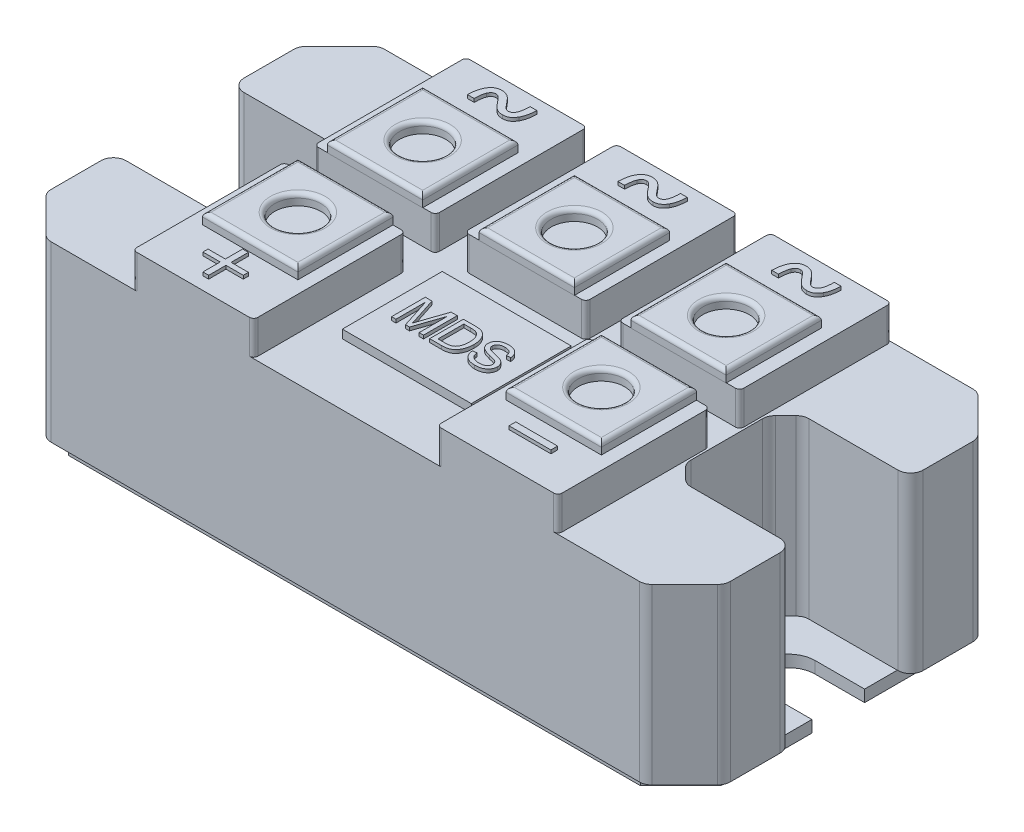
from build123d import *

# Parameters (mm, degrees)
BOSS_EXTRUDE1_DEPTH = 20.6
SKETCH2_R           = 3.125
BOSS_EXTRUDE2_DEPTH = 1.4
SKETCH3_W           = 14.35
SKETCH3_H           = 18
BOSS_EXTRUDE3_DEPTH = 4
SKETCH4_W           = 15.3
SKETCH4_H           = 11.85
BOSS_EXTRUDE4_DEPTH = 1
FILLET1_R           = 0.5
SKETCH5_W           = 11.3
SKETCH5_H           = 11.3
SKETCH5_R           = 2.75
BOSS_EXTRUDE5_DEPTH = 1.3
FILLET2_R           = 0.5
BOSS_EXTRUDE6_DEPTH = 0.4
SKETCH7_W           = 4.962025316
SKETCH7_H           = 0.797468355
BOSS_EXTRUDE7_DEPTH = 0.4


with BuildPart() as part:
    # Sketch1 → Boss-Extrude1 (new body)
    with BuildSketch(Plane(origin=(0, 0, 0), x_dir=(1, 0, 0), z_dir=(0, 1, 0))):
        with BuildLine():
            Line((35.941369055, 19.335660172), (39.835660172, 15.441369055))
            ThreePointArc((39.835660172, 15.441369055), (40.160819299, 14.954734032), (40.275, 14.380708883))
            Line((40.275, 14.380708883), (40.275, 8.5))
            ThreePointArc((40.275, 8.5), (39.835660172, 7.439339828), (38.775, 7))
            Line((38.775, 7), (28.217640687, 7))
            ThreePointArc((28.217640687, 7), (27.643615539, 6.885819299), (27.156980515, 6.560660172))
            Line((27.156980515, 6.560660172), (25.914339828, 5.318019485))
            ThreePointArc((25.914339828, 5.318019485), (25.589180701, 4.831384461), (25.475, 4.257359313))
            Line((25.475, 4.257359313), (25.475, -4.257359313))
            ThreePointArc((25.475, -4.257359313), (25.589180701, -4.831384461), (25.914339828, -5.318019485))
            Line((25.914339828, -5.318019485), (27.156980515, -6.560660172))
            ThreePointArc((27.156980515, -6.560660172), (27.643615539, -6.885819299), (28.217640687, -7))
            Line((28.217640687, -7), (38.775, -7))
            ThreePointArc((38.775, -7), (39.835660172, -7.439339828), (40.275, -8.5))
            Line((40.275, -8.5), (40.275, -14.380708883))
            ThreePointArc((40.275, -14.380708883), (40.160819299, -14.954734032), (39.835660172, -15.441369055))
            Line((39.835660172, -15.441369055), (35.941369055, -19.335660172))
            ThreePointArc((35.941369055, -19.335660172), (35.454734032, -19.660819299), (34.880708883, -19.775))
            Line((34.880708883, -19.775), (-34.880708883, -19.775))
            ThreePointArc((-34.880708883, -19.775), (-35.454734032, -19.660819299), (-35.941369055, -19.335660172))
            Line((-35.941369055, -19.335660172), (-39.835660172, -15.441369055))
            ThreePointArc((-39.835660172, -15.441369055), (-40.160819299, -14.954734032), (-40.275, -14.380708883))
            Line((-40.275, -14.380708883), (-40.275, -8.5))
            ThreePointArc((-40.275, -8.5), (-39.835660172, -7.439339828), (-38.775, -7))
            Line((-38.775, -7), (-28.217640687, -7))
            ThreePointArc((-28.217640687, -7), (-27.643615539, -6.885819299), (-27.156980515, -6.560660172))
            Line((-27.156980515, -6.560660172), (-25.914339828, -5.318019485))
            ThreePointArc((-25.914339828, -5.318019485), (-25.589180701, -4.831384461), (-25.475, -4.257359313))
            Line((-25.475, -4.257359313), (-25.475, 4.257359313))
            ThreePointArc((-25.475, 4.257359313), (-25.589180701, 4.831384461), (-25.914339828, 5.318019485))
            Line((-25.914339828, 5.318019485), (-27.156980515, 6.560660172))
            ThreePointArc((-27.156980515, 6.560660172), (-27.643615539, 6.885819299), (-28.217640687, 7))
            Line((-28.217640687, 7), (-38.775, 7))
            ThreePointArc((-38.775, 7), (-39.835660172, 7.439339828), (-40.275, 8.5))
            Line((-40.275, 8.5), (-40.275, 14.380708883))
            ThreePointArc((-40.275, 14.380708883), (-40.160819299, 14.954734032), (-39.835660172, 15.441369055))
            Line((-39.835660172, 15.441369055), (-35.941369055, 19.335660172))
            ThreePointArc((-35.941369055, 19.335660172), (-35.454734032, 19.660819299), (-34.880708883, 19.775))
            Line((-34.880708883, 19.775), (34.880708883, 19.775))
            ThreePointArc((34.880708883, 19.775), (35.454734032, 19.660819299), (35.941369055, 19.335660172))
        make_face()
    extrude(amount=BOSS_EXTRUDE1_DEPTH)

    # Sketch2 → Boss-Extrude2 (add)
    with BuildSketch(Plane.XZ):
        with BuildLine():
            Line((33.927029227, 18.7), (38.7, 13.927029227))
            Line((38.7, 13.927029227), (38.7, 3.125))
            Line((38.7, 3.125), (32.825, 3.125))
            ThreePointArc((32.825, 3.125), (29.7, 0), (32.825, -3.125))
            Line((32.825, -3.125), (38.7, -3.125))
            Line((38.7, -3.125), (38.7, -13.927029227))
            Line((38.7, -13.927029227), (33.927029227, -18.7))
            Line((33.927029227, -18.7), (-33.927029227, -18.7))
            Line((-33.927029227, -18.7), (-38.7, -13.927029227))
            Line((-38.7, -13.927029227), (-38.7, 13.927029227))
            Line((-38.7, 13.927029227), (-33.927029227, 18.7))
            Line((-33.927029227, 18.7), (33.927029227, 18.7))
        make_face()
        with Locations(Location((-33.325, 0, 0), (0, 0, 270))):
            Circle(SKETCH2_R, mode=Mode.SUBTRACT)
    extrude(amount=BOSS_EXTRUDE2_DEPTH)

    # Sketch3 → Boss-Extrude3 (add)
    with BuildSketch(Plane(origin=(0, 20.6, 0), x_dir=(1, 0, 0), z_dir=(0, 1, 0))):
        with Locations((-18.05, 10.775)):
            Rectangle(SKETCH3_W, SKETCH3_H)
        with Locations((-0.2, 10.775)):
            Rectangle(SKETCH3_W, SKETCH3_H)
        with Locations((-18.05, -10.775)):
            Rectangle(SKETCH3_W, SKETCH3_H)
        with Locations((18.05, -10.775)):
            Rectangle(SKETCH3_W, SKETCH3_H)
        with Locations((18.05, 10.775)):
            Rectangle(SKETCH3_W, SKETCH3_H)
    extrude(amount=BOSS_EXTRUDE3_DEPTH)

    # Sketch4 → Boss-Extrude4 (add)
    with BuildSketch(Plane(origin=(0, 20.6, 0), x_dir=(1, 0, 0), z_dir=(0, 1, 0))):
        with Locations((0, -6.55)):
            Rectangle(SKETCH4_W, SKETCH4_H)
    extrude(amount=BOSS_EXTRUDE4_DEPTH)

    # Fillet1
    fillet1_edges = [part.edges().sort_by_distance(p)[0] for p in [
        (-25.225, 22.6, -19.775),
        (-25.225, 22.6, -1.775),
        (-10.875, 22.6, -1.775),
        (-10.875, 22.6, -19.775),
        (-7.375, 22.6, -19.775),
        (-7.375, 22.6, -1.775),
        (6.975, 22.6, -1.775),
        (6.975, 22.6, -19.775),
        (-25.225, 22.6, 1.775),
        (-25.225, 22.6, 19.775),
        (-10.875, 22.6, 19.775),
        (-10.875, 22.6, 1.775),
        (10.875, 22.6, 19.775),
        (25.225, 22.6, 19.775),
        (25.225, 22.6, 1.775),
        (10.875, 22.6, 1.775),
        (25.225, 22.6, -1.775),
        (25.225, 22.6, -19.775),
        (10.875, 22.6, -19.775),
        (10.875, 22.6, -1.775),
    ]]
    fillet(fillet1_edges, radius=FILLET1_R)

    # Sketch5 → Boss-Extrude5 (add)
    # profile 1 of 5: a face of its own
    with BuildSketch(Plane(origin=(0, 24.6, 0), x_dir=(1, 0, 0), z_dir=(0, 1, 0))):
        with Locations((-18, 7.4)):
            Rectangle(SKETCH5_W, SKETCH5_H)
        with Locations(Location((-18, 7.4, 0), (0, 0, 270))):
            Circle(SKETCH5_R, mode=Mode.SUBTRACT)
    # profile 2 of 5: a face of its own
    with BuildSketch(Plane(origin=(0, 24.6, 0), x_dir=(1, 0, 0), z_dir=(0, 1, 0))):
        with Locations((-18, -7.4)):
            Rectangle(SKETCH5_W, SKETCH5_H)
        with Locations(Location((-18, -7.4, 0), (0, 0, 90))):
            Circle(SKETCH5_R, mode=Mode.SUBTRACT)
    # profile 3 of 5: a face of its own
    with BuildSketch(Plane(origin=(0, 24.6, 0), x_dir=(1, 0, 0), z_dir=(0, 1, 0))):
        with Locations((0, 7.4)):
            Rectangle(SKETCH5_W, SKETCH5_H)
        with Locations(Location((0, 7.4, 0), (0, 0, 270))):
            Circle(SKETCH5_R, mode=Mode.SUBTRACT)
    # profile 4 of 5: a face of its own
    with BuildSketch(Plane(origin=(0, 24.6, 0), x_dir=(1, 0, 0), z_dir=(0, 1, 0))):
        with Locations((18, -7.4)):
            Rectangle(SKETCH5_W, SKETCH5_H)
        with Locations(Location((18, -7.4, 0), (0, 0, 270))):
            Circle(SKETCH5_R, mode=Mode.SUBTRACT)
    # profile 5 of 5: a face of its own
    with BuildSketch(Plane(origin=(0, 24.6, 0), x_dir=(1, 0, 0), z_dir=(0, 1, 0))):
        with Locations((18, 7.4)):
            Rectangle(SKETCH5_W, SKETCH5_H)
        with Locations(Location((18, 7.4, 0), (0, 0, 90))):
            Circle(SKETCH5_R, mode=Mode.SUBTRACT)
    extrude(amount=BOSS_EXTRUDE5_DEPTH)

    # Fillet2
    fillet2_edges = [part.edges().sort_by_distance(p)[0] for p in [
        (-12.35, 25.9, -7.4),
        (-18, 25.9, -13.05),
        (-23.65, 25.9, -7.4),
        (-18, 25.9, -1.75),
        (-18, 25.9, -10.15),
        (-23.65, 25.9, 7.4),
        (-18, 25.9, 13.05),
        (-12.35, 25.9, 7.4),
        (-18, 25.9, 1.75),
        (-18, 25.9, 10.15),
        (18, 25.9, 13.05),
        (23.65, 25.9, 7.4),
        (18, 25.9, 1.75),
        (12.35, 25.9, 7.4),
        (18, 25.9, 4.65),
        (0, 25.9, -1.75),
        (5.65, 25.9, -7.4),
        (0, 25.9, -13.05),
        (-5.65, 25.9, -7.4),
        (0, 25.9, -10.15),
        (23.65, 25.9, -7.4),
        (18, 25.9, -13.05),
        (12.35, 25.9, -7.4),
        (18, 25.9, -1.75),
        (18, 25.9, -4.65),
    ]]
    fillet(fillet2_edges, radius=FILLET2_R)

    # Sketch6 → Boss-Extrude6 (add)
    # profile 1 of 3: a face of its own
    with BuildSketch(Plane(origin=(0, 21.6, 0), x_dir=(1, 0, 0), z_dir=(0, 1, 0))):
        with BuildLine():
            Line((-5.61038961, -8.675), (-5.61038961, -4.675))
            Line((-5.61038961, -4.675), (-4.814123377, -4.675))
            Line((-4.814123377, -4.675), (-3.897727273, -7.506980519))
            Line((-3.897727273, -7.506980519), (-3.714285714, -8.099512987))
            add(Edge.make_bspline(
                [(-3.714285714, -8.099512987), (-3.708124422, -8.080012463), (-3.695183616, -8.039054737), (-3.673424555, -7.974690503), (-3.651579147, -7.903338906), (-3.624964623, -7.826616538), (-3.597600565, -7.743386437), (-3.567452698, -7.654138609), (-3.535017811, -7.558348299), (-3.512462849, -7.492364374), (-3.500811688, -7.458279221)],
                knots=[0, 0, 0, 0, 0.726206643, 1.525280629, 2.41254226, 3.3756825, 4.408698438, 5.523752133, 6.720850731, 8, 8, 8, 8], degree=3))
            Line((-3.500811688, -7.458279221), (-2.540584416, -4.675))
            Line((-2.540584416, -4.675), (-1.818181818, -4.675))
            Line((-1.818181818, -4.675), (-1.818181818, -8.675))
            Line((-1.818181818, -8.675), (-2.337662338, -8.675))
            Line((-2.337662338, -8.675), (-2.337662338, -5.344642857))
            Line((-2.337662338, -5.344642857), (-3.478896104, -8.675))
            Line((-3.478896104, -8.675), (-3.959415584, -8.675))
            Line((-3.959415584, -8.675), (-5.090909091, -5.153084416))
            Line((-5.090909091, -5.153084416), (-5.090909091, -8.675))
            Line((-5.090909091, -8.675), (-5.61038961, -8.675))
        make_face()
    # profile 2 of 3: a face of its own
    with BuildSketch(Plane(origin=(0, 21.6, 0), x_dir=(1, 0, 0), z_dir=(0, 1, 0))):
        with BuildLine():
            Line((-1.090909091, -8.675), (-1.090909091, -4.675))
            Line((-1.090909091, -4.675), (0.254058442, -4.675))
            add(Edge.make_bspline(
                [(0.254058442, -4.675), (0.294377577, -4.674986737), (0.372603763, -4.674961006), (0.485971365, -4.679572288), (0.592082981, -4.684912952), (0.690648411, -4.692785045), (0.781788891, -4.703692315), (0.865406335, -4.715044428), (0.941371973, -4.730837284), (0.989217944, -4.743018746), (1.012175325, -4.748863636)],
                knots=[0, 0, 0, 0, 1.266758978, 2.457734333, 3.564536452, 4.60520355, 5.563769428, 6.448665684, 7.255641162, 8, 8, 8, 8], degree=3))
            add(Edge.make_bspline(
                [(1.012175325, -4.748863636), (1.067694226, -4.766558165), (1.177591326, -4.801583668), (1.331792877, -4.880760389), (1.474656998, -4.978423988), (1.605226169, -5.096491426), (1.72271177, -5.232746722), (1.828070091, -5.385115011), (1.918202597, -5.554773429), (1.981137421, -5.707608358), (2.023812423, -5.83795782), (2.052103887, -5.941188999), (2.07679565, -6.048603554), (2.095836003, -6.160864534), (2.111508386, -6.277514259), (2.121669161, -6.398883909), (2.128362531, -6.524492128), (2.129362499, -6.609785439), (2.12987013, -6.653084416)],
                knots=[0, 0, 0, 0, 1.174939958, 2.325739354, 3.485014877, 4.661046704, 5.869351209, 7.110508248, 8.39375832, 9.741116344, 10.442557281, 11.162270702, 11.901824798, 12.667085315, 13.460627751, 14.277760841, 15.125708784, 16, 16, 16, 16], degree=3))
            add(Edge.make_bspline(
                [(2.12987013, -6.653084416), (2.128955395, -6.708562388), (2.127155521, -6.817723366), (2.117017105, -6.978178875), (2.098046659, -7.13228479), (2.072487384, -7.279782199), (2.038911797, -7.42092757), (1.998830696, -7.555953081), (1.949698762, -7.684166117), (1.89490603, -7.805727351), (1.83393895, -7.919498366), (1.768131114, -8.025116581), (1.698682108, -8.122360501), (1.625190242, -8.211381608), (1.546220898, -8.290393649), (1.464327095, -8.362465832), (1.377817487, -8.425520931), (1.285941937, -8.479323276), (1.188658485, -8.525822861), (1.084845385, -8.565492604), (0.974308394, -8.599781605), (0.85619351, -8.626922699), (0.731069753, -8.649013647), (0.598793655, -8.664126076), (0.45953945, -8.673040333), (0.364461496, -8.674336095), (0.315746753, -8.675)],
                knots=[0, 0, 0, 0, 1.285715154, 2.529831556, 3.723588108, 4.88221712, 5.996958211, 7.083952729, 8.143624279, 9.176239757, 10.172051745, 11.132413866, 12.05807102, 12.939524071, 13.804068042, 14.643979477, 15.465434267, 16.280523422, 17.107819848, 17.961311883, 18.853756929, 19.787553604, 20.767848595, 21.796764639, 22.871136387, 24, 24, 24, 24], degree=3))
            Line((0.315746753, -8.675), (-1.090909091, -8.675))
        make_face()
        with BuildLine():
            Line((-0.571428571, -8.207467532), (0.261363636, -8.207467532))
            add(Edge.make_bspline(
                [(0.261363636, -8.207467532), (0.301959097, -8.206980122), (0.38076802, -8.206033901), (0.495284858, -8.199320752), (0.602408114, -8.18950494), (0.701615776, -8.173346359), (0.79372573, -8.155977999), (0.877362638, -8.130726613), (0.954360275, -8.103850635), (1.024091194, -8.070929487), (1.088016929, -8.033147311), (1.147808523, -7.990580199), (1.204006626, -7.942736971), (1.255592461, -7.888974137), (1.30408184, -7.830799202), (1.34880766, -7.767415501), (1.389306428, -7.69820254), (1.413185643, -7.649455799), (1.425324675, -7.624675325)],
                knots=[0, 0, 0, 0, 1.399613218, 2.717102087, 3.954472952, 5.106316911, 6.182096002, 7.182899304, 8.115414993, 8.991784568, 9.836551414, 10.672671811, 11.51959932, 12.377248504, 13.238441918, 14.12880119, 15.048773465, 16, 16, 16, 16], degree=3))
            add(Edge.make_bspline(
                [(1.425324675, -7.624675325), (1.440041466, -7.589923146), (1.469842725, -7.519550555), (1.508042117, -7.409914671), (1.539437661, -7.29510013), (1.565538626, -7.175354804), (1.585563564, -7.050416961), (1.600387776, -6.920434268), (1.608141092, -6.785484022), (1.609631667, -6.693947873), (1.61038961, -6.647402597)],
                knots=[0, 0, 0, 0, 0.903756617, 1.830092274, 2.778115259, 3.753021271, 4.764043945, 5.807424391, 6.885095823, 8, 8, 8, 8], degree=3))
            add(Edge.make_bspline(
                [(1.61038961, -6.647402597), (1.609727853, -6.597876177), (1.608439386, -6.501446353), (1.59957341, -6.360837876), (1.584558894, -6.228532634), (1.56225808, -6.104527961), (1.535469033, -5.988458649), (1.500772233, -5.880747918), (1.461821032, -5.78063021), (1.414888222, -5.689332856), (1.36368943, -5.605818233), (1.309398343, -5.52912511), (1.251314114, -5.459926351), (1.190876256, -5.396773137), (1.125069122, -5.342237315), (1.056569779, -5.294374681), (0.984210558, -5.253823988), (0.933665783, -5.232691768), (0.908279221, -5.222077922)],
                knots=[0, 0, 0, 0, 1.405967995, 2.737473178, 3.997961424, 5.183757421, 6.312767343, 7.376752277, 8.393730332, 9.359009516, 10.286414865, 11.173068977, 12.023760497, 12.849393044, 13.650913521, 14.445670304, 15.219324079, 16, 16, 16, 16], degree=3))
            add(Edge.make_bspline(
                [(0.908279221, -5.222077922), (0.889695732, -5.215578533), (0.850538141, -5.201883557), (0.786678855, -5.18601512), (0.715390998, -5.172474313), (0.636615689, -5.16091549), (0.550125712, -5.153531506), (0.456272112, -5.146473754), (0.354719899, -5.143885698), (0.284631545, -5.142993815), (0.248376623, -5.142532468)],
                knots=[0, 0, 0, 0, 0.707244417, 1.490247, 2.361773456, 3.314767917, 4.350080781, 5.480735599, 6.696848651, 8, 8, 8, 8], degree=3))
            Line((0.248376623, -5.142532468), (-0.571428571, -5.142532468))
            Line((-0.571428571, -5.142532468), (-0.571428571, -8.207467532))
        make_face(mode=Mode.SUBTRACT)
    # profile 3 of 3: a face of its own
    with BuildSketch(Plane(origin=(0, 21.6, 0), x_dir=(1, 0, 0), z_dir=(0, 1, 0))):
        with BuildLine():
            Line((2.701298701, -7.376298701), (3.168831169, -7.324350649))
            add(Edge.make_bspline(
                [(3.168831169, -7.324350649), (3.176340939, -7.377327904), (3.190626927, -7.478107617), (3.228863621, -7.618778097), (3.278717952, -7.741678221), (3.343040619, -7.847419155), (3.422807384, -7.937601065), (3.515432279, -8.017728991), (3.622891414, -8.08835895), (3.743512739, -8.149888195), (3.876106393, -8.199152216), (4.01834238, -8.233637632), (4.168437733, -8.255304925), (4.271298885, -8.258025367), (4.323863636, -8.259415584)],
                knots=[0, 0, 0, 0, 1.162815379, 2.212047466, 3.161707124, 4.038726961, 4.889553997, 5.769726749, 6.695101972, 7.679354139, 8.708998216, 9.763694405, 10.857189086, 12, 12, 12, 12], degree=3))
            add(Edge.make_bspline(
                [(4.323863636, -8.259415584), (4.36149402, -8.258790151), (4.434429437, -8.257577934), (4.540639527, -8.248283785), (4.640372426, -8.234514079), (4.733369648, -8.212566003), (4.8208706, -8.187677025), (4.900862729, -8.153871251), (4.975138408, -8.115710808), (5.042218093, -8.071154994), (5.102227275, -8.021791863), (5.154778722, -7.968523739), (5.199832704, -7.912000763), (5.235483778, -7.850995424), (5.264875654, -7.787437233), (5.283593495, -7.719375381), (5.296605109, -7.648169509), (5.297992693, -7.599304707), (5.298701299, -7.574350649)],
                knots=[0, 0, 0, 0, 1.35233248, 2.621098287, 3.83001208, 4.967128563, 6.053240012, 7.095311951, 8.082721221, 9.051028926, 9.9836646, 10.870772999, 11.736515156, 12.573768008, 13.405183114, 14.24542405, 15.103981045, 16, 16, 16, 16], degree=3))
            add(Edge.make_bspline(
                [(5.298701299, -7.574350649), (5.297683238, -7.545577219), (5.295695304, -7.489392261), (5.277936702, -7.407879275), (5.249789223, -7.331814882), (5.209189478, -7.261780332), (5.157295725, -7.19790006), (5.094201363, -7.139865978), (5.01906669, -7.088589851), (4.947111111, -7.050607122), (4.878204122, -7.02194055), (4.812679449, -6.997841567), (4.733609942, -6.971924026), (4.641230158, -6.944629455), (4.535685782, -6.915436366), (4.416775543, -6.884800815), (4.284837718, -6.851381156), (4.192130423, -6.829365536), (4.143668831, -6.817857143)],
                knots=[0, 0, 0, 0, 0.916104664, 1.788848314, 2.645769488, 3.49186081, 4.356514409, 5.259742896, 6.214213058, 7.248052071, 7.847074344, 8.591965525, 9.472809354, 10.498705084, 11.661979767, 12.962989187, 14.412440187, 16, 16, 16, 16], degree=3))
            add(Edge.make_bspline(
                [(4.143668831, -6.817857143), (4.100060837, -6.807219164), (4.015899037, -6.786688263), (3.894735798, -6.753956511), (3.782711604, -6.722035795), (3.680529546, -6.688572175), (3.587483243, -6.655518564), (3.504101816, -6.621574446), (3.429891943, -6.587442356), (3.344176001, -6.542959966), (3.249738155, -6.480664728), (3.149234992, -6.396783802), (3.061547983, -6.303886379), (2.98816366, -6.201833735), (2.928789104, -6.091974005), (2.887603606, -5.973573514), (2.861360709, -5.848502677), (2.858564083, -5.762524625), (2.857142857, -5.718831169)],
                knots=[0, 0, 0, 0, 1.164454861, 2.247354366, 3.255881247, 4.1859514, 5.036323886, 5.81710277, 6.520605073, 7.154828166, 8.320995384, 9.447097958, 10.544550058, 11.625719254, 12.699664114, 13.771956115, 14.867723368, 16, 16, 16, 16], degree=3))
            add(Edge.make_bspline(
                [(2.857142857, -5.718831169), (2.858216768, -5.679540352), (2.860330622, -5.602201431), (2.877552113, -5.488848932), (2.906865182, -5.381044197), (2.947855294, -5.27912412), (2.999095038, -5.182287936), (3.063009445, -5.091578668), (3.13934375, -5.007288965), (3.225112921, -4.927823057), (3.320467001, -4.855236932), (3.426023727, -4.794039304), (3.538662635, -4.74093443), (3.659102076, -4.696800927), (3.78807435, -4.663814746), (3.924937358, -4.640756681), (4.069737771, -4.625605962), (4.169062085, -4.623917377), (4.219967532, -4.623051948)],
                knots=[0, 0, 0, 0, 0.960256834, 1.890142101, 2.795180156, 3.685719122, 4.570540281, 5.46793153, 6.390802793, 7.34571353, 8.323378249, 9.313760082, 10.322787061, 11.364900047, 12.444646488, 13.572360775, 14.755792447, 16, 16, 16, 16], degree=3))
            add(Edge.make_bspline(
                [(4.219967532, -4.623051948), (4.289316616, -4.624689893), (4.424231682, -4.627876431), (4.619964023, -4.654735992), (4.802304156, -4.700250071), (4.970784037, -4.762971617), (5.123365158, -4.843757949), (5.259491604, -4.939272798), (5.376507469, -5.052429101), (5.458345708, -5.159078622), (5.514874785, -5.250727749), (5.551034488, -5.323268966), (5.583237116, -5.398101962), (5.608951239, -5.476451927), (5.630040555, -5.557528858), (5.646203096, -5.641570734), (5.658019658, -5.728542739), (5.660883912, -5.787787512), (5.662337662, -5.817857143)],
                knots=[0, 0, 0, 0, 1.583974498, 3.081540673, 4.502860407, 5.87030138, 7.178281716, 8.437285517, 9.657023653, 10.882341282, 11.498312504, 12.114810821, 12.732516653, 13.358060341, 13.996782451, 14.645389409, 15.312468632, 16, 16, 16, 16], degree=3))
            Line((5.662337662, -5.817857143), (5.194805195, -5.869805195))
            add(Edge.make_bspline(
                [(5.194805195, -5.869805195), (5.190940262, -5.837806785), (5.183396113, -5.775347537), (5.164670333, -5.685518021), (5.140611951, -5.601558723), (5.108991246, -5.524681374), (5.071146964, -5.454197315), (5.028581616, -5.389507552), (4.978117847, -5.332216048), (4.92214035, -5.28090659), (4.859788663, -5.236127688), (4.791878274, -5.196864133), (4.71794653, -5.163569584), (4.637854436, -5.137099303), (4.552189812, -5.11564189), (4.460325137, -5.101652899), (4.362739703, -5.092473067), (4.295747367, -5.09122499), (4.261363636, -5.090584416)],
                knots=[0, 0, 0, 0, 1.131756525, 2.209130438, 3.219617986, 4.195638117, 5.122576386, 6.026723669, 6.909180997, 7.797199498, 8.688821757, 9.600084306, 10.548695315, 11.531494245, 12.559572992, 13.647086039, 14.792369936, 16, 16, 16, 16], degree=3))
            add(Edge.make_bspline(
                [(4.261363636, -5.090584416), (4.226443595, -5.090958746), (4.158666311, -5.091685294), (4.060251396, -5.099941462), (3.968233928, -5.113387685), (3.882642508, -5.133210329), (3.803034298, -5.156864186), (3.729987056, -5.18729767), (3.663380441, -5.222918872), (3.603205942, -5.263384376), (3.549931086, -5.308387675), (3.503832784, -5.356972069), (3.464191727, -5.408419849), (3.432225593, -5.463614267), (3.407070205, -5.521904104), (3.389078888, -5.583485736), (3.37822075, -5.648096068), (3.377162394, -5.692273356), (3.376623377, -5.714772727)],
                knots=[0, 0, 0, 0, 1.378201176, 2.674989139, 3.895506129, 5.04591762, 6.140586707, 7.170055899, 8.164005682, 9.117895186, 10.027336126, 10.911268581, 11.757215555, 12.58523919, 13.422510946, 14.257326553, 15.112461219, 16, 16, 16, 16], degree=3))
            add(Edge.make_bspline(
                [(3.376623377, -5.714772727), (3.377054862, -5.735630849), (3.377892647, -5.77612955), (3.385388105, -5.834803707), (3.3972228, -5.889930732), (3.415560155, -5.941042054), (3.437342421, -5.989383325), (3.464069264, -6.034432809), (3.496677434, -6.075056107), (3.521645281, -6.098960894), (3.534090909, -6.110876623)],
                knots=[0, 0, 0, 0, 1.138015241, 2.209601583, 3.223566131, 4.209060914, 5.167289295, 6.114529505, 7.060156606, 8, 8, 8, 8], degree=3))
            add(Edge.make_bspline(
                [(3.534090909, -6.110876623), (3.54922485, -6.122934242), (3.582209979, -6.149214383), (3.642757612, -6.182263505), (3.715172509, -6.216636897), (3.801628562, -6.249459192), (3.901177194, -6.281440693), (4.013783738, -6.3132149), (4.139796623, -6.343757536), (4.228580909, -6.36297129), (4.275162338, -6.373051948)],
                knots=[0, 0, 0, 0, 0.585146858, 1.275354783, 2.081874102, 3.013294601, 4.073280169, 5.248527622, 6.556416687, 8, 8, 8, 8], degree=3))
            add(Edge.make_bspline(
                [(4.275162338, -6.373051948), (4.320907433, -6.382698033), (4.408978834, -6.401269296), (4.535643129, -6.429555982), (4.651574657, -6.457482314), (4.757412978, -6.482788943), (4.852161322, -6.509136755), (4.936346814, -6.533338665), (5.01030568, -6.55562499), (5.055263976, -6.572252788), (5.076298701, -6.580032468)],
                knots=[0, 0, 0, 0, 1.354960269, 2.608656721, 3.761262021, 4.811096771, 5.762257901, 6.611034033, 7.350141775, 8, 8, 8, 8], degree=3))
            add(Edge.make_bspline(
                [(5.076298701, -6.580032468), (5.105143402, -6.591563958), (5.16163985, -6.614150021), (5.242327771, -6.653878463), (5.318877693, -6.695314855), (5.389242365, -6.742201893), (5.455721322, -6.790729036), (5.5168143, -6.84366476), (5.572433769, -6.900589461), (5.624097545, -6.959715959), (5.669583254, -7.022531543), (5.709751539, -7.08825278), (5.742686616, -7.157596922), (5.770867548, -7.229277587), (5.791644152, -7.304443169), (5.80723865, -7.382257906), (5.816171131, -7.463212827), (5.817503986, -7.518052507), (5.818181818, -7.545941558)],
                knots=[0, 0, 0, 0, 1.143595362, 2.239894117, 3.31030232, 4.34668468, 5.351103288, 6.340031211, 7.319425495, 8.280243859, 9.228947196, 10.172245371, 11.112591778, 12.052621374, 13.005241214, 13.980368408, 14.972904105, 16, 16, 16, 16], degree=3))
            add(Edge.make_bspline(
                [(5.818181818, -7.545941558), (5.817529071, -7.573836378), (5.816239247, -7.628956381), (5.80679569, -7.710836978), (5.792787855, -7.790784881), (5.771209701, -7.868905816), (5.743484388, -7.944630435), (5.711091648, -8.019275017), (5.671847831, -8.091676806), (5.61164614, -8.184976001), (5.52405169, -8.293698129), (5.400925418, -8.408605272), (5.260123261, -8.506588789), (5.129679881, -8.572565885), (5.018146638, -8.617933888), (4.928842212, -8.646953999), (4.835232523, -8.671124678), (4.737706391, -8.691358922), (4.636184178, -8.707735435), (4.530247524, -8.719011155), (4.419992735, -8.725382705), (4.344975641, -8.726420286), (4.306818182, -8.726948052)],
                knots=[0, 0, 0, 0, 0.778525382, 1.53836165, 2.298348054, 3.042251481, 3.797229868, 4.54800306, 5.311733262, 6.093184067, 7.645483155, 9.195189299, 10.779191089, 12.417471056, 13.264598258, 14.138768214, 15.036408913, 15.96220544, 16.918314263, 17.905856232, 18.93481339, 20, 20, 20, 20], degree=3))
            add(Edge.make_bspline(
                [(4.306818182, -8.726948052), (4.247792896, -8.7259081), (4.132462006, -8.723876113), (3.964231951, -8.706571468), (3.805139828, -8.678419558), (3.655188079, -8.63867558), (3.514278042, -8.587731438), (3.382706296, -8.524881264), (3.260302839, -8.450714216), (3.147562598, -8.365729471), (3.046045257, -8.270797049), (2.95678631, -8.167443582), (2.881525893, -8.054894098), (2.819206235, -7.934747524), (2.768929272, -7.806719679), (2.732837813, -7.670540439), (2.708757214, -7.526180851), (2.703821166, -7.426988765), (2.701298701, -7.376298701)],
                knots=[0, 0, 0, 0, 1.201459697, 2.347560271, 3.438871862, 4.487749606, 5.501931785, 6.485000003, 7.451429773, 8.411006407, 9.354125374, 10.276028933, 11.185055718, 12.104041828, 13.026718527, 13.979440501, 14.967434866, 16, 16, 16, 16], degree=3))
        make_face()
    extrude(amount=BOSS_EXTRUDE6_DEPTH)

    # Sketch7 → Boss-Extrude7 (add)
    with BuildSketch(Plane(origin=(0, 24.6, 0), x_dir=(1, 0, 0), z_dir=(0, 1, 0))):
        with BuildLine():
            add(Edge.make_bspline(
                [(-15.170253165, 18.116772152), (-15.172831847, 18.038285957), (-15.177965542, 17.882033983), (-15.197142976, 17.650010817), (-15.228156698, 17.422378852), (-15.26747446, 17.200356199), (-15.31808082, 16.985964185), (-15.381619747, 16.781667063), (-15.45868223, 16.5883943), (-15.521398399, 16.466918435), (-15.552373418, 16.406922468)],
                knots=[0, 0, 0, 0, 1.065676022, 2.121570328, 3.157964907, 4.182596386, 5.180696186, 6.145438931, 7.084046994, 8, 8, 8, 8], degree=3))
            add(Edge.make_bspline(
                [(-15.552373418, 16.406922468), (-15.585412875, 16.351727708), (-15.650241943, 16.243426146), (-15.765292393, 16.09562108), (-15.891507781, 15.963349907), (-16.030570821, 15.846624349), (-16.187071808, 15.749574947), (-16.366890399, 15.683741826), (-16.567225643, 15.643013927), (-16.708214024, 15.638247408), (-16.781803797, 15.635759494)],
                knots=[0, 0, 0, 0, 1.006723996, 1.975364715, 2.926205726, 3.865521301, 4.812563667, 5.7938767, 6.848500059, 8, 8, 8, 8], degree=3))
            add(Edge.make_bspline(
                [(-16.781803797, 15.635759494), (-16.825694837, 15.636349428), (-16.910942976, 15.637495237), (-17.03532178, 15.652383132), (-17.153268507, 15.673488171), (-17.298618063, 15.716232459), (-17.466286699, 15.784712337), (-17.586210643, 15.860628637), (-17.644343354, 15.897428797)],
                knots=[0, 0, 0, 0, 0.862193595, 1.674610604, 2.459203871, 3.214296151, 4.649639806, 6, 6, 6, 6], degree=3))
            add(Edge.make_bspline(
                [(-17.644343354, 15.897428797), (-17.698865959, 15.939199921), (-17.810957331, 16.025075911), (-17.960792208, 16.176237842), (-18.098174708, 16.332101449), (-18.186677192, 16.43454393), (-18.228599684, 16.48306962)],
                knots=[0, 0, 0, 0, 0.992854241, 2.041178983, 3.072131595, 4, 4, 4, 4], degree=3))
            add(Edge.make_bspline(
                [(-18.228599684, 16.48306962), (-18.270773073, 16.534618633), (-18.355393372, 16.638050983), (-18.47737984, 16.79350128), (-18.594451748, 16.943539083), (-18.678396035, 17.033711787), (-18.718710443, 17.077017405)],
                knots=[0, 0, 0, 0, 1.03748139, 2.081691439, 3.078728555, 4, 4, 4, 4], degree=3))
            add(Edge.make_bspline(
                [(-18.718710443, 17.077017405), (-18.760376466, 17.123039704), (-18.840250518, 17.211264765), (-18.955279266, 17.302568303), (-19.051140178, 17.358386726), (-19.127031859, 17.388163226), (-19.208096353, 17.404756183), (-19.263666516, 17.40684863), (-19.291890823, 17.407911392)],
                knots=[0, 0, 0, 0, 1.630248723, 3.125197948, 3.836943034, 4.53984493, 5.258381435, 6, 6, 6, 6], degree=3))
            add(Edge.make_bspline(
                [(-19.291890823, 17.407911392), (-19.329385928, 17.406284997), (-19.401932081, 17.403138219), (-19.50589387, 17.379829498), (-19.599242225, 17.338393133), (-19.683588491, 17.282237618), (-19.759069747, 17.209982155), (-19.827125008, 17.123076539), (-19.888236217, 17.020884985), (-19.922140011, 16.945872502), (-19.939833861, 16.906724684)],
                knots=[0, 0, 0, 0, 1.02662268, 1.986326599, 2.897527145, 3.80899065, 4.747825288, 5.746683476, 6.824030017, 8, 8, 8, 8], degree=3))
            add(Edge.make_bspline(
                [(-19.939833861, 16.906724684), (-19.955846476, 16.86498311), (-19.98883397, 16.778991544), (-20.024594647, 16.640344656), (-20.057532785, 16.49098977), (-20.086911448, 16.273214814), (-20.114506649, 15.987035993), (-20.126274705, 15.754429613), (-20.132278481, 15.635759494)],
                knots=[0, 0, 0, 0, 0.622720061, 1.282861883, 1.993221638, 2.753802826, 4.343869126, 6, 6, 6, 6], degree=3))
            Line((-20.132278481, 15.635759494), (-20.929746835, 15.635759494))
            add(Edge.make_bspline(
                [(-20.929746835, 15.635759494), (-20.927365077, 15.716106831), (-20.922662784, 15.874736138), (-20.900911814, 16.109814266), (-20.870580305, 16.339372279), (-20.831599051, 16.563472561), (-20.778847665, 16.777777119), (-20.717380835, 16.980928441), (-20.643102243, 17.170073839), (-20.582729698, 17.287905591), (-20.553164557, 17.345609177)],
                knots=[0, 0, 0, 0, 1.09185376, 2.155640885, 3.205553307, 4.23743163, 5.244144279, 6.202052276, 7.119523996, 8, 8, 8, 8], degree=3))
            add(Edge.make_bspline(
                [(-20.553164557, 17.345609177), (-20.520466675, 17.402869295), (-20.456274255, 17.515282247), (-20.336437624, 17.665230599), (-20.204165837, 17.798844527), (-20.055669082, 17.912883072), (-19.892008343, 18.005096085), (-19.713115802, 18.070822992), (-19.520229244, 18.110404007), (-19.386689463, 18.114613223), (-19.318196203, 18.116772152)],
                knots=[0, 0, 0, 0, 1.029321938, 2.020762825, 2.989935018, 3.962403771, 4.937731199, 5.914604694, 6.930389698, 8, 8, 8, 8], degree=3))
            add(Edge.make_bspline(
                [(-19.318196203, 18.116772152), (-19.272467642, 18.116135523), (-19.183554149, 18.114897676), (-19.0543807, 18.100703607), (-18.933660356, 18.077981182), (-18.787643703, 18.032982153), (-18.619479703, 17.963417759), (-18.499021156, 17.886822603), (-18.440427215, 17.849564873)],
                knots=[0, 0, 0, 0, 0.88223175, 1.715389787, 2.504984428, 3.248947562, 4.661821773, 6, 6, 6, 6], degree=3))
            add(Edge.make_bspline(
                [(-18.440427215, 17.849564873), (-18.386703163, 17.80931682), (-18.278574325, 17.728310731), (-18.13586737, 17.582520445), (-17.99659709, 17.430796972), (-17.909625787, 17.323468885), (-17.865862342, 17.269462025)],
                knots=[0, 0, 0, 0, 0.982108274, 1.9766608, 2.981867671, 4, 4, 4, 4], degree=3))
            add(Edge.make_bspline(
                [(-17.865862342, 17.269462025), (-17.827891561, 17.22295295), (-17.744429752, 17.12072351), (-17.640092119, 16.988125519), (-17.551512874, 16.877406762), (-17.487585675, 16.80184517), (-17.43121917, 16.73419806), (-17.393477118, 16.694267573), (-17.375751582, 16.675514241)],
                knots=[0, 0, 0, 0, 1.403065055, 3.084012148, 3.943015892, 4.71629677, 5.397109445, 6, 6, 6, 6], degree=3))
            add(Edge.make_bspline(
                [(-17.375751582, 16.675514241), (-17.331375315, 16.627155254), (-17.248035072, 16.536335321), (-17.129795892, 16.442434419), (-17.032749695, 16.390489603), (-16.959679363, 16.363559479), (-16.884437075, 16.348194656), (-16.83355739, 16.345811982), (-16.808109177, 16.344620253)],
                knots=[0, 0, 0, 0, 1.739566127, 3.266968374, 3.973177998, 4.650705229, 5.325130618, 6, 6, 6, 6], degree=3))
            add(Edge.make_bspline(
                [(-16.808109177, 16.344620253), (-16.770120697, 16.34609789), (-16.696495264, 16.348961696), (-16.590936292, 16.374500326), (-16.494884365, 16.416761215), (-16.408137219, 16.475498024), (-16.332559939, 16.550253094), (-16.263771973, 16.635116694), (-16.20501282, 16.733003583), (-16.175395433, 16.804757524), (-16.160166139, 16.841653481)],
                knots=[0, 0, 0, 0, 1.042031772, 2.019560654, 2.961524964, 3.910624182, 4.87865866, 5.870299206, 6.904905479, 8, 8, 8, 8], degree=3))
            add(Edge.make_bspline(
                [(-16.160166139, 16.841653481), (-16.144753271, 16.882977813), (-16.113093634, 16.967862294), (-16.076725639, 17.103373406), (-16.044326261, 17.248747162), (-16.011751022, 17.462957109), (-15.98075306, 17.75324907), (-15.972191838, 17.992069782), (-15.967721519, 18.116772152)],
                knots=[0, 0, 0, 0, 0.612433314, 1.258001784, 1.947181282, 2.680825927, 4.266863575, 6, 6, 6, 6], degree=3))
            Line((-15.967721519, 18.116772152), (-15.170253165, 18.116772152))
        make_face()
        with BuildLine():
            add(Edge.make_bspline(
                [(2.679746835, 18.116772152), (2.677168153, 18.038285957), (2.672034458, 17.882033983), (2.652857024, 17.650010817), (2.621843302, 17.422378852), (2.58252554, 17.200356199), (2.53191918, 16.985964185), (2.468380253, 16.781667063), (2.39131777, 16.5883943), (2.328601601, 16.466918435), (2.297626582, 16.406922468)],
                knots=[0, 0, 0, 0, 1.065676022, 2.121570328, 3.157964907, 4.182596386, 5.180696186, 6.145438931, 7.084046994, 8, 8, 8, 8], degree=3))
            add(Edge.make_bspline(
                [(2.297626582, 16.406922468), (2.264587125, 16.351727708), (2.199758057, 16.243426146), (2.084707607, 16.09562108), (1.958492219, 15.963349907), (1.819429179, 15.846624349), (1.662928192, 15.749574947), (1.483109601, 15.683741826), (1.282774357, 15.643013927), (1.141785976, 15.638247408), (1.068196203, 15.635759494)],
                knots=[0, 0, 0, 0, 1.006723996, 1.975364715, 2.926205726, 3.865521301, 4.812563667, 5.7938767, 6.848500059, 8, 8, 8, 8], degree=3))
            add(Edge.make_bspline(
                [(1.068196203, 15.635759494), (1.024305163, 15.636349428), (0.939057024, 15.637495237), (0.81467822, 15.652383132), (0.696731493, 15.673488171), (0.551381937, 15.716232459), (0.383713301, 15.784712337), (0.263789357, 15.860628637), (0.205656646, 15.897428797)],
                knots=[0, 0, 0, 0, 0.862193595, 1.674610604, 2.459203871, 3.214296151, 4.649639806, 6, 6, 6, 6], degree=3))
            add(Edge.make_bspline(
                [(0.205656646, 15.897428797), (0.151134041, 15.939199921), (0.039042669, 16.025075911), (-0.110792208, 16.176237842), (-0.248174708, 16.332101449), (-0.336677192, 16.43454393), (-0.378599684, 16.48306962)],
                knots=[0, 0, 0, 0, 0.992854241, 2.041178983, 3.072131595, 4, 4, 4, 4], degree=3))
            add(Edge.make_bspline(
                [(-0.378599684, 16.48306962), (-0.420773073, 16.534618633), (-0.505393372, 16.638050983), (-0.62737984, 16.79350128), (-0.744451748, 16.943539083), (-0.828396035, 17.033711787), (-0.868710443, 17.077017405)],
                knots=[0, 0, 0, 0, 1.03748139, 2.081691439, 3.078728555, 4, 4, 4, 4], degree=3))
            add(Edge.make_bspline(
                [(-0.868710443, 17.077017405), (-0.910376466, 17.123039704), (-0.990250518, 17.211264765), (-1.105279266, 17.302568303), (-1.201140178, 17.358386726), (-1.277031859, 17.388163226), (-1.358096353, 17.404756183), (-1.413666516, 17.40684863), (-1.441890823, 17.407911392)],
                knots=[0, 0, 0, 0, 1.630248723, 3.125197948, 3.836943034, 4.53984493, 5.258381435, 6, 6, 6, 6], degree=3))
            add(Edge.make_bspline(
                [(-1.441890823, 17.407911392), (-1.479385928, 17.406284997), (-1.551932081, 17.403138219), (-1.65589387, 17.379829498), (-1.749242225, 17.338393133), (-1.833588491, 17.282237618), (-1.909069747, 17.209982155), (-1.977125008, 17.123076539), (-2.038236217, 17.020884985), (-2.072140011, 16.945872502), (-2.089833861, 16.906724684)],
                knots=[0, 0, 0, 0, 1.02662268, 1.986326599, 2.897527145, 3.80899065, 4.747825288, 5.746683476, 6.824030017, 8, 8, 8, 8], degree=3))
            add(Edge.make_bspline(
                [(-2.089833861, 16.906724684), (-2.105846476, 16.86498311), (-2.13883397, 16.778991544), (-2.174594647, 16.640344656), (-2.207532785, 16.49098977), (-2.236911448, 16.273214814), (-2.264506649, 15.987035993), (-2.276274705, 15.754429613), (-2.282278481, 15.635759494)],
                knots=[0, 0, 0, 0, 0.622720061, 1.282861883, 1.993221638, 2.753802826, 4.343869126, 6, 6, 6, 6], degree=3))
            Line((-2.282278481, 15.635759494), (-3.079746835, 15.635759494))
            add(Edge.make_bspline(
                [(-3.079746835, 15.635759494), (-3.077365077, 15.716106831), (-3.072662784, 15.874736138), (-3.050911814, 16.109814266), (-3.020580305, 16.339372279), (-2.981599051, 16.563472561), (-2.928847665, 16.777777119), (-2.867380835, 16.980928441), (-2.793102243, 17.170073839), (-2.732729698, 17.287905591), (-2.703164557, 17.345609177)],
                knots=[0, 0, 0, 0, 1.09185376, 2.155640885, 3.205553307, 4.23743163, 5.244144279, 6.202052276, 7.119523996, 8, 8, 8, 8], degree=3))
            add(Edge.make_bspline(
                [(-2.703164557, 17.345609177), (-2.670466675, 17.402869295), (-2.606274255, 17.515282247), (-2.486437624, 17.665230599), (-2.354165837, 17.798844527), (-2.205669082, 17.912883072), (-2.042008343, 18.005096085), (-1.863115802, 18.070822992), (-1.670229244, 18.110404007), (-1.536689463, 18.114613223), (-1.468196203, 18.116772152)],
                knots=[0, 0, 0, 0, 1.029321938, 2.020762825, 2.989935018, 3.962403771, 4.937731199, 5.914604694, 6.930389698, 8, 8, 8, 8], degree=3))
            add(Edge.make_bspline(
                [(-1.468196203, 18.116772152), (-1.422467642, 18.116135523), (-1.333554149, 18.114897676), (-1.2043807, 18.100703607), (-1.083660356, 18.077981182), (-0.937643703, 18.032982153), (-0.769479703, 17.963417759), (-0.649021156, 17.886822603), (-0.590427215, 17.849564873)],
                knots=[0, 0, 0, 0, 0.88223175, 1.715389787, 2.504984428, 3.248947562, 4.661821773, 6, 6, 6, 6], degree=3))
            add(Edge.make_bspline(
                [(-0.590427215, 17.849564873), (-0.536703163, 17.80931682), (-0.428574325, 17.728310731), (-0.28586737, 17.582520445), (-0.14659709, 17.430796972), (-0.059625787, 17.323468885), (-0.015862342, 17.269462025)],
                knots=[0, 0, 0, 0, 0.982108274, 1.9766608, 2.981867671, 4, 4, 4, 4], degree=3))
            add(Edge.make_bspline(
                [(-0.015862342, 17.269462025), (0.022108439, 17.22295295), (0.105570248, 17.12072351), (0.209907881, 16.988125519), (0.298487126, 16.877406762), (0.362414325, 16.80184517), (0.41878083, 16.73419806), (0.456522882, 16.694267573), (0.474248418, 16.675514241)],
                knots=[0, 0, 0, 0, 1.403065055, 3.084012148, 3.943015892, 4.71629677, 5.397109445, 6, 6, 6, 6], degree=3))
            add(Edge.make_bspline(
                [(0.474248418, 16.675514241), (0.518624685, 16.627155254), (0.601964928, 16.536335321), (0.720204108, 16.442434419), (0.817250305, 16.390489603), (0.890320637, 16.363559479), (0.965562925, 16.348194656), (1.01644261, 16.345811982), (1.041890823, 16.344620253)],
                knots=[0, 0, 0, 0, 1.739566127, 3.266968374, 3.973177998, 4.650705229, 5.325130618, 6, 6, 6, 6], degree=3))
            add(Edge.make_bspline(
                [(1.041890823, 16.344620253), (1.079879303, 16.34609789), (1.153504736, 16.348961696), (1.259063708, 16.374500326), (1.355115635, 16.416761215), (1.441862781, 16.475498024), (1.517440061, 16.550253094), (1.586228027, 16.635116694), (1.64498718, 16.733003583), (1.674604567, 16.804757524), (1.689833861, 16.841653481)],
                knots=[0, 0, 0, 0, 1.042031772, 2.019560654, 2.961524964, 3.910624182, 4.87865866, 5.870299206, 6.904905479, 8, 8, 8, 8], degree=3))
            add(Edge.make_bspline(
                [(1.689833861, 16.841653481), (1.705246729, 16.882977813), (1.736906366, 16.967862294), (1.773274361, 17.103373406), (1.805673739, 17.248747162), (1.838248978, 17.462957109), (1.86924694, 17.75324907), (1.877808162, 17.992069782), (1.882278481, 18.116772152)],
                knots=[0, 0, 0, 0, 0.612433314, 1.258001784, 1.947181282, 2.680825927, 4.266863575, 6, 6, 6, 6], degree=3))
            Line((1.882278481, 18.116772152), (2.679746835, 18.116772152))
        make_face()
        with BuildLine():
            add(Edge.make_bspline(
                [(20.929746835, 18.116772152), (20.927168153, 18.038285957), (20.922034458, 17.882033983), (20.902857024, 17.650010817), (20.871843302, 17.422378852), (20.83252554, 17.200356199), (20.78191918, 16.985964185), (20.718380253, 16.781667063), (20.64131777, 16.5883943), (20.578601601, 16.466918435), (20.547626582, 16.406922468)],
                knots=[0, 0, 0, 0, 1.065676022, 2.121570328, 3.157964907, 4.182596386, 5.180696186, 6.145438931, 7.084046994, 8, 8, 8, 8], degree=3))
            add(Edge.make_bspline(
                [(20.547626582, 16.406922468), (20.514587125, 16.351727708), (20.449758057, 16.243426146), (20.334707607, 16.09562108), (20.208492219, 15.963349907), (20.069429179, 15.846624349), (19.912928192, 15.749574947), (19.733109601, 15.683741826), (19.532774357, 15.643013927), (19.391785976, 15.638247408), (19.318196203, 15.635759494)],
                knots=[0, 0, 0, 0, 1.006723996, 1.975364715, 2.926205726, 3.865521301, 4.812563667, 5.7938767, 6.848500059, 8, 8, 8, 8], degree=3))
            add(Edge.make_bspline(
                [(19.318196203, 15.635759494), (19.274305163, 15.636349428), (19.189057024, 15.637495237), (19.06467822, 15.652383132), (18.946731493, 15.673488171), (18.801381937, 15.716232459), (18.633713301, 15.784712337), (18.513789357, 15.860628637), (18.455656646, 15.897428797)],
                knots=[0, 0, 0, 0, 0.862193595, 1.674610604, 2.459203871, 3.214296151, 4.649639806, 6, 6, 6, 6], degree=3))
            add(Edge.make_bspline(
                [(18.455656646, 15.897428797), (18.401134041, 15.939199921), (18.289042669, 16.025075911), (18.139207792, 16.176237842), (18.001825292, 16.332101449), (17.913322808, 16.43454393), (17.871400316, 16.48306962)],
                knots=[0, 0, 0, 0, 0.992854241, 2.041178983, 3.072131595, 4, 4, 4, 4], degree=3))
            add(Edge.make_bspline(
                [(17.871400316, 16.48306962), (17.829226927, 16.534618633), (17.744606628, 16.638050983), (17.62262016, 16.79350128), (17.505548252, 16.943539083), (17.421603965, 17.033711787), (17.381289557, 17.077017405)],
                knots=[0, 0, 0, 0, 1.03748139, 2.081691439, 3.078728555, 4, 4, 4, 4], degree=3))
            add(Edge.make_bspline(
                [(17.381289557, 17.077017405), (17.339623534, 17.123039704), (17.259749482, 17.211264765), (17.144720734, 17.302568303), (17.048859822, 17.358386726), (16.972968141, 17.388163226), (16.891903647, 17.404756183), (16.836333484, 17.40684863), (16.808109177, 17.407911392)],
                knots=[0, 0, 0, 0, 1.630248723, 3.125197948, 3.836943034, 4.53984493, 5.258381435, 6, 6, 6, 6], degree=3))
            add(Edge.make_bspline(
                [(16.808109177, 17.407911392), (16.770614072, 17.406284997), (16.698067919, 17.403138219), (16.59410613, 17.379829498), (16.500757775, 17.338393133), (16.416411509, 17.282237618), (16.340930253, 17.209982155), (16.272874992, 17.123076539), (16.211763783, 17.020884985), (16.177859989, 16.945872502), (16.160166139, 16.906724684)],
                knots=[0, 0, 0, 0, 1.02662268, 1.986326599, 2.897527145, 3.80899065, 4.747825288, 5.746683476, 6.824030017, 8, 8, 8, 8], degree=3))
            add(Edge.make_bspline(
                [(16.160166139, 16.906724684), (16.144153524, 16.86498311), (16.11116603, 16.778991544), (16.075405353, 16.640344656), (16.042467215, 16.49098977), (16.013088552, 16.273214814), (15.985493351, 15.987035993), (15.973725295, 15.754429613), (15.967721519, 15.635759494)],
                knots=[0, 0, 0, 0, 0.622720061, 1.282861883, 1.993221638, 2.753802826, 4.343869126, 6, 6, 6, 6], degree=3))
            Line((15.967721519, 15.635759494), (15.170253165, 15.635759494))
            add(Edge.make_bspline(
                [(15.170253165, 15.635759494), (15.172634923, 15.716106831), (15.177337216, 15.874736138), (15.199088186, 16.109814266), (15.229419695, 16.339372279), (15.268400949, 16.563472561), (15.321152335, 16.777777119), (15.382619165, 16.980928441), (15.456897757, 17.170073839), (15.517270302, 17.287905591), (15.546835443, 17.345609177)],
                knots=[0, 0, 0, 0, 1.09185376, 2.155640885, 3.205553307, 4.23743163, 5.244144279, 6.202052276, 7.119523996, 8, 8, 8, 8], degree=3))
            add(Edge.make_bspline(
                [(15.546835443, 17.345609177), (15.579533325, 17.402869295), (15.643725745, 17.515282247), (15.763562376, 17.665230599), (15.895834163, 17.798844527), (16.044330918, 17.912883072), (16.207991657, 18.005096085), (16.386884198, 18.070822992), (16.579770756, 18.110404007), (16.713310537, 18.114613223), (16.781803797, 18.116772152)],
                knots=[0, 0, 0, 0, 1.029321938, 2.020762825, 2.989935018, 3.962403771, 4.937731199, 5.914604694, 6.930389698, 8, 8, 8, 8], degree=3))
            add(Edge.make_bspline(
                [(16.781803797, 18.116772152), (16.827532358, 18.116135523), (16.916445851, 18.114897676), (17.0456193, 18.100703607), (17.166339644, 18.077981182), (17.312356297, 18.032982153), (17.480520297, 17.963417759), (17.600978844, 17.886822603), (17.659572785, 17.849564873)],
                knots=[0, 0, 0, 0, 0.88223175, 1.715389787, 2.504984428, 3.248947562, 4.661821773, 6, 6, 6, 6], degree=3))
            add(Edge.make_bspline(
                [(17.659572785, 17.849564873), (17.713296837, 17.80931682), (17.821425675, 17.728310731), (17.96413263, 17.582520445), (18.10340291, 17.430796972), (18.190374213, 17.323468885), (18.234137658, 17.269462025)],
                knots=[0, 0, 0, 0, 0.982108274, 1.9766608, 2.981867671, 4, 4, 4, 4], degree=3))
            add(Edge.make_bspline(
                [(18.234137658, 17.269462025), (18.272108439, 17.22295295), (18.355570248, 17.12072351), (18.459907881, 16.988125519), (18.548487126, 16.877406762), (18.612414325, 16.80184517), (18.66878083, 16.73419806), (18.706522882, 16.694267573), (18.724248418, 16.675514241)],
                knots=[0, 0, 0, 0, 1.403065055, 3.084012148, 3.943015892, 4.71629677, 5.397109445, 6, 6, 6, 6], degree=3))
            add(Edge.make_bspline(
                [(18.724248418, 16.675514241), (18.768624685, 16.627155254), (18.851964928, 16.536335321), (18.970204108, 16.442434419), (19.067250305, 16.390489603), (19.140320637, 16.363559479), (19.215562925, 16.348194656), (19.26644261, 16.345811982), (19.291890823, 16.344620253)],
                knots=[0, 0, 0, 0, 1.739566127, 3.266968374, 3.973177998, 4.650705229, 5.325130618, 6, 6, 6, 6], degree=3))
            add(Edge.make_bspline(
                [(19.291890823, 16.344620253), (19.329879303, 16.34609789), (19.403504736, 16.348961696), (19.509063708, 16.374500326), (19.605115635, 16.416761215), (19.691862781, 16.475498024), (19.767440061, 16.550253094), (19.836228027, 16.635116694), (19.89498718, 16.733003583), (19.924604567, 16.804757524), (19.939833861, 16.841653481)],
                knots=[0, 0, 0, 0, 1.042031772, 2.019560654, 2.961524964, 3.910624182, 4.87865866, 5.870299206, 6.904905479, 8, 8, 8, 8], degree=3))
            add(Edge.make_bspline(
                [(19.939833861, 16.841653481), (19.955246729, 16.882977813), (19.986906366, 16.967862294), (20.023274361, 17.103373406), (20.055673739, 17.248747162), (20.088248978, 17.462957109), (20.11924694, 17.75324907), (20.127808162, 17.992069782), (20.132278481, 18.116772152)],
                knots=[0, 0, 0, 0, 0.612433314, 1.258001784, 1.947181282, 2.680825927, 4.266863575, 6, 6, 6, 6], degree=3))
            Line((20.132278481, 18.116772152), (20.929746835, 18.116772152))
        make_face()
        Polygon((-15.657594937, -16.22056962), (-17.708227848, -16.22056962), (-17.708227848, -18.271202532), (-18.391772152, -18.271202532), (-18.391772152, -16.22056962), (-20.442405063, -16.22056962), (-20.442405063, -15.612974684), (-18.391772152, -15.612974684), (-18.391772152, -13.562341772), (-17.708227848, -13.562341772), (-17.708227848, -15.612974684), (-15.657594937, -15.612974684), align=None)
        with Locations((18.05, -15.518037975)):
            Rectangle(SKETCH7_W, SKETCH7_H)
    extrude(amount=BOSS_EXTRUDE7_DEPTH)


solid = part.part
